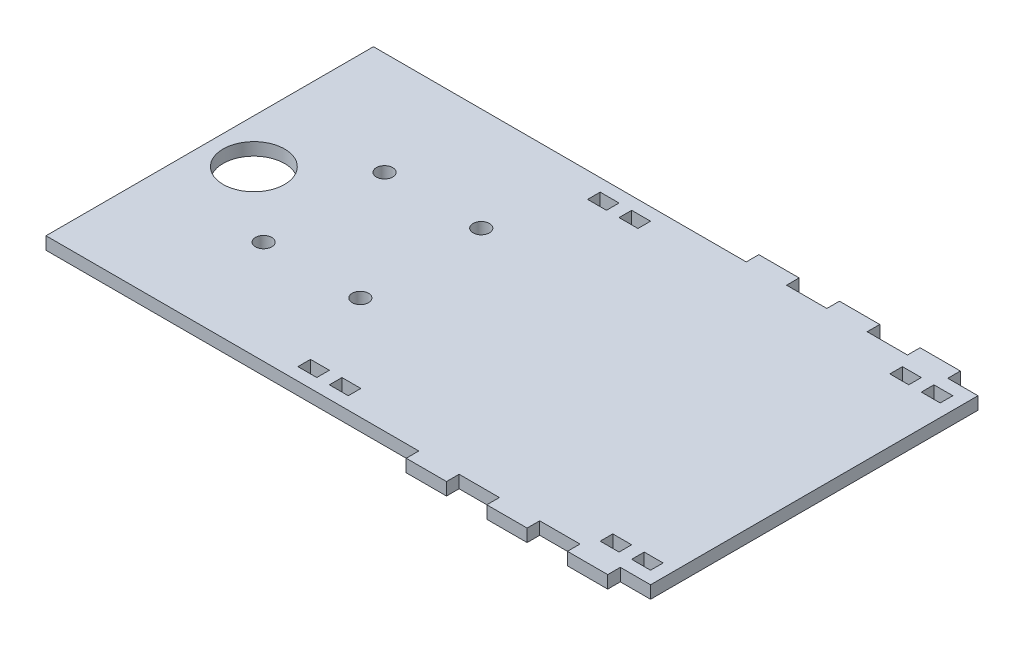
from build123d import *

# Parameters (mm, degrees)
SKETCH1_R                   = 7.747
BOSS_EXTRUDE1_DEPTH         = 3.175
SKETCH2_R                   = 2.06375
CASTER_MOUNTING_HOLES_DEPTH = 89.274136218
SKETCH3_W                   = 4.7625
SKETCH3_H                   = 3.175
CUT_EXTRUDE1_DEPTH          = 89.274136218
LPATTERN1_COUNT             = 2
LPATTERN1_PITCH             = 76.2
LPATTERN1_COUNT_DIR2        = 2
LPATTERN1_PITCH_DIR2        = 73.025


with BuildPart() as part:
    # Sketch1 → Boss-Extrude1 (new body)
    with BuildSketch(Plane(origin=(0, 0, 0), x_dir=(1, 0, 0), z_dir=(0, 1, 0))):
        Polygon((27.94, -41.275), (38.1, -41.275), (38.1, -44.45), (48.26, -44.45), (48.26, -41.275), (58.42, -41.275), (58.42, -44.45), (68.58, -44.45), (68.58, -41.275), (76.2, -41.275), (76.2, 41.275), (68.58, 41.275), (68.58, 44.45), (58.42, 44.45), (58.42, 41.275), (48.26, 41.275), (48.26, 44.45), (38.1, 44.45), (38.1, 41.275), (27.94, 41.275), (27.94, 44.45), (17.78, 44.45), (17.78, 41.275), (-76.2, 41.275), (-76.2, -41.275), (17.78, -41.275), (17.78, -44.45), (27.94, -44.45), align=None)
        with Locations((-65.076590574, 0)):
            Circle(SKETCH1_R, mode=Mode.SUBTRACT)
    extrude(amount=BOSS_EXTRUDE1_DEPTH)

    # Sketch2 → Caster Mounting Holes (cut, through all)
    with BuildSketch(Plane(origin=(0, 3.175, 0), x_dir=(1, 0, 0), z_dir=(0, 1, 0))):
        with Locations((-47.3754273, 15.24)):
            Circle(SKETCH2_R)
        with Locations((-22.9914273, 15.24)):
            Circle(SKETCH2_R)
        with Locations((-22.9914273, -15.24)):
            Circle(SKETCH2_R)
        with Locations((-47.3754273, -15.24)):
            Circle(SKETCH2_R)
    extrude(amount=-CASTER_MOUNTING_HOLES_DEPTH, mode=Mode.SUBTRACT)

    # Sketch3 → Cut-Extrude1 (cut, through all)
    with BuildSketch(Plane(origin=(0, 3.175, 0), x_dir=(1, 0, 0), z_dir=(0, 1, 0))):
        with Locations((62.70625, 36.5125)):
            Rectangle(SKETCH3_W, SKETCH3_H)
        with Locations((70.64375, 36.5125)):
            Rectangle(SKETCH3_W, SKETCH3_H)
    cut_extrude1 = extrude(amount=-CUT_EXTRUDE1_DEPTH, mode=Mode.SUBTRACT)

    # LPattern1: Cut-Extrude1 2 × 2
    with Locations(*[(-i * LPATTERN1_PITCH, 0, j * LPATTERN1_PITCH_DIR2) for i in range(LPATTERN1_COUNT) for j in range(LPATTERN1_COUNT_DIR2) if (i, j) != (0, 0)]):
        add(cut_extrude1, mode=Mode.SUBTRACT)


solid = part.part
